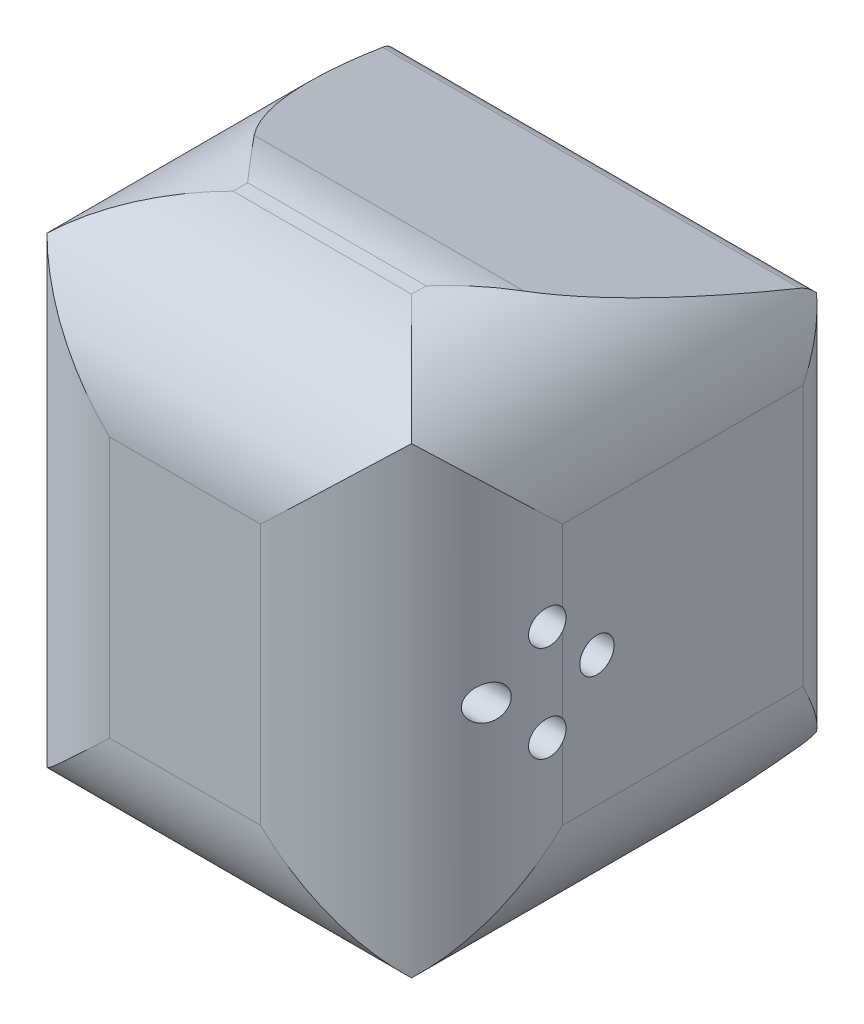
from build123d import *

# Parameters (mm, degrees)
BOSS_1_DEPTH    = 66
CUT_2_DEPTH     = 80
CUT_3_DEPTH     = 80
CUT_4_DEPTH     = 80
CUT_5_DEPTH     = 80
CUT_6_DEPTH     = 62.2
CUT_7_DEPTH     = 62.2
CUT_8_DEPTH     = 62.2
CUT_9_DEPTH     = 62.2
S_CUT10_W       = 52
S_CUT10_H       = 48
POCKET_10_DEPTH = 16.2
S_CUT11_W       = 52
S_CUT11_H       = 60
POCKET_11_DEPTH = 36
S_CUT12_W       = 36
S_CUT12_H       = 48
POCKET_12_DEPTH = 6.1
S_CUT13_W       = 7.2
S_CUT13_H       = 32
POCKET_13_DEPTH = 28
S_HOLE14_R      = 2.5
HOLE_14_DEPTH   = 7.2
S_HOLE15_R      = 2.5
HOLE_15_DEPTH   = 7.2
S_HOLE16_R      = 2.5
HOLE_16_DEPTH   = 7.2
S_HOLE17_R      = 2.5
HOLE_17_DEPTH   = 7.2
S_HOLE18_R      = 1.2
HOLE_18_DEPTH   = 7.2
S_HOLE19_R      = 2.3
HOLE_19_DEPTH   = 2
S_HOLE20_R      = 1.2
HOLE_20_DEPTH   = 7.2
S_HOLE21_R      = 2.3
HOLE_21_DEPTH   = 2


with BuildPart() as part:
    # S_prism1 → Boss_1 (new body)
    with BuildSketch(Plane(origin=(-33, 0, 0), x_dir=(0, 0, -1), z_dir=(1, 0, 0))):
        with BuildLine():
            Line((0, -25.0397), (0, 25.0397))
            ThreePointArc((0, 25.0397), (-0.784802451, 27.419203311), (-2.8311, 28.8651))
            Line((-2.8311, 28.8651), (-32.2859, 37.8651))
            ThreePointArc((-32.2859, 37.8651), (-36.042603994, 38.714700597), (-39.8836, 39))
            Line((-39.8836, 39), (-42, 39))
            ThreePointArc((-42, 39), (-56.1421, 33.1421), (-62, 19))
            Line((-62, 19), (-62, -19))
            ThreePointArc((-62, -19), (-56.1421, -33.1421), (-42, -39))
            Line((-42, -39), (-39.8836, -39))
            ThreePointArc((-39.8836, -39), (-36.042603994, -38.714700597), (-32.2859, -37.8651))
            Line((-32.2859, -37.8651), (-2.8311, -28.8651))
            ThreePointArc((-2.8311, -28.8651), (-0.784802451, -27.419203311), (0, -25.0397))
        make_face()
    extrude(amount=BOSS_1_DEPTH)

    # S_pcut2 → Cut_2 (cut)
    with BuildSketch(Plane(origin=(0, -40, 0), x_dir=(1, 0, 0), z_dir=(0, 1, 0))):
        with BuildLine():
            Line((33.6, -62.6), (11, -62.6))
            Line((11, -62.6), (11, -62))
            ThreePointArc((11, -62), (26.5563, -55.5563), (33, -40))
            Line((33, -40), (33.6, -40))
            Line((33.6, -40), (33.6, -62.6))
        make_face()
    extrude(amount=CUT_2_DEPTH, mode=Mode.SUBTRACT)

    # S_pcut3 → Cut_3 (cut)
    with BuildSketch(Plane(origin=(0, -40, 0), x_dir=(1, 0, 0), z_dir=(0, 1, 0))):
        with BuildLine():
            Line((-33.6, -62.6), (-11, -62.6))
            Line((-11, -62.6), (-11, -62))
            ThreePointArc((-11, -62), (-26.5563, -55.5563), (-33, -40))
            Line((-33, -40), (-33.6, -40))
            Line((-33.6, -40), (-33.6, -62.6))
        make_face()
    extrude(amount=CUT_3_DEPTH, mode=Mode.SUBTRACT)

    # S_pcut4 → Cut_4 (cut)
    with BuildSketch(Plane(origin=(0, -40, 0), x_dir=(1, 0, 0), z_dir=(0, 1, 0))):
        with BuildLine():
            Line((33.6, 0.6), (28, 0.6))
            Line((28, 0.6), (28, 0))
            ThreePointArc((28, 0), (31.5355, -1.4645), (33, -5))
            Line((33, -5), (33.6, -5))
            Line((33.6, -5), (33.6, 0.6))
        make_face()
    extrude(amount=CUT_4_DEPTH, mode=Mode.SUBTRACT)

    # S_pcut5 → Cut_5 (cut)
    with BuildSketch(Plane(origin=(0, -40, 0), x_dir=(1, 0, 0), z_dir=(0, 1, 0))):
        with BuildLine():
            Line((-33.6, 0.6), (-28, 0.6))
            Line((-28, 0.6), (-28, 0))
            ThreePointArc((-28, 0), (-31.5355, -1.4645), (-33, -5))
            Line((-33, -5), (-33.6, -5))
            Line((-33.6, -5), (-33.6, 0.6))
        make_face()
    extrude(amount=CUT_5_DEPTH, mode=Mode.SUBTRACT)

    # S_pcut6 → Cut_6 (cut)
    with BuildSketch(Plane.XY.offset(-0.1)):
        with BuildLine():
            Line((33.6, 39.6), (13, 39.6))
            Line((13, 39.6), (13, 39))
            ThreePointArc((13, 39), (27.1421, 33.1421), (33, 19))
            Line((33, 19), (33.6, 19))
            Line((33.6, 19), (33.6, 39.6))
        make_face()
    extrude(amount=CUT_6_DEPTH, mode=Mode.SUBTRACT)

    # S_pcut7 → Cut_7 (cut)
    with BuildSketch(Plane.XY.offset(-0.1)):
        with BuildLine():
            Line((33.6, -39.6), (13, -39.6))
            Line((13, -39.6), (13, -39))
            ThreePointArc((13, -39), (27.1421, -33.1421), (33, -19))
            Line((33, -19), (33.6, -19))
            Line((33.6, -19), (33.6, -39.6))
        make_face()
    extrude(amount=CUT_7_DEPTH, mode=Mode.SUBTRACT)

    # S_pcut8 → Cut_8 (cut)
    with BuildSketch(Plane.XY.offset(-0.1)):
        with BuildLine():
            Line((-33.6, 39.6), (-13, 39.6))
            Line((-13, 39.6), (-13, 39))
            ThreePointArc((-13, 39), (-27.1421, 33.1421), (-33, 19))
            Line((-33, 19), (-33.6, 19))
            Line((-33.6, 19), (-33.6, 39.6))
        make_face()
    extrude(amount=CUT_8_DEPTH, mode=Mode.SUBTRACT)

    # S_pcut9 → Cut_9 (cut)
    with BuildSketch(Plane.XY.offset(-0.1)):
        with BuildLine():
            Line((-33.6, -39.6), (-13, -39.6))
            Line((-13, -39.6), (-13, -39))
            ThreePointArc((-13, -39), (-27.1421, -33.1421), (-33, -19))
            Line((-33, -19), (-33.6, -19))
            Line((-33.6, -19), (-33.6, -39.6))
        make_face()
    extrude(amount=CUT_9_DEPTH, mode=Mode.SUBTRACT)

    # S_cut10 → Pocket_10 (cut)
    with BuildSketch(Plane.XY.offset(-0.1)):
        Rectangle(S_CUT10_W, S_CUT10_H)
    extrude(amount=POCKET_10_DEPTH, mode=Mode.SUBTRACT)

    # S_cut11 → Pocket_11 (cut)
    with BuildSketch(Plane.XY.offset(16)):
        Rectangle(S_CUT11_W, S_CUT11_H)
    extrude(amount=POCKET_11_DEPTH, mode=Mode.SUBTRACT)

    # S_cut12 → Pocket_12 (cut)
    with BuildSketch(Plane.XY.offset(51.9)):
        Rectangle(S_CUT12_W, S_CUT12_H)
    extrude(amount=POCKET_12_DEPTH, mode=Mode.SUBTRACT)

    # S_cut13 → Pocket_13 (cut)
    with BuildSketch(Plane.XY.offset(16)):
        with Locations((-29.5, 0)):
            Rectangle(S_CUT13_W, S_CUT13_H)
    extrude(amount=POCKET_13_DEPTH, mode=Mode.SUBTRACT)

    # S_hole14 → Hole_14 (cut)
    with BuildSketch(Plane(origin=(25.9, 0, 0), x_dir=(0, 0, -1), z_dir=(1, 0, 0))):
        with Locations(Location((-49, 0, 0), (0, 0, 180))):
            Circle(S_HOLE14_R)
    extrude(amount=HOLE_14_DEPTH, mode=Mode.SUBTRACT)

    # S_hole15 → Hole_15 (cut)
    with BuildSketch(Plane(origin=(25.9, 0, 0), x_dir=(0, 0, -1), z_dir=(1, 0, 0))):
        with Locations(Location((-42, 7, 0), (0, 0, 180))):
            Circle(S_HOLE15_R)
    extrude(amount=HOLE_15_DEPTH, mode=Mode.SUBTRACT)

    # S_hole16 → Hole_16 (cut)
    with BuildSketch(Plane(origin=(25.9, 0, 0), x_dir=(0, 0, -1), z_dir=(1, 0, 0))):
        with Locations(Location((-42, -7, 0), (0, 0, 180))):
            Circle(S_HOLE16_R)
    extrude(amount=HOLE_16_DEPTH, mode=Mode.SUBTRACT)

    # S_hole17 → Hole_17 (cut)
    with BuildSketch(Plane(origin=(25.9, 0, 0), x_dir=(0, 0, -1), z_dir=(1, 0, 0))):
        with Locations(Location((-35, 0, 0), (0, 0, 180))):
            Circle(S_HOLE17_R)
    extrude(amount=HOLE_17_DEPTH, mode=Mode.SUBTRACT)

    # S_hole18 → Hole_18 (cut)
    with BuildSketch(Plane(origin=(-33.1, 0, 0), x_dir=(0, 0, -1), z_dir=(1, 0, 0))):
        with Locations((-8, -10)):
            Circle(S_HOLE18_R)
    extrude(amount=HOLE_18_DEPTH, mode=Mode.SUBTRACT)

    # S_hole19 → Hole_19 (cut)
    with BuildSketch(Plane(origin=(-33.1, 0, 0), x_dir=(0, 0, -1), z_dir=(1, 0, 0))):
        with Locations((-8, -10)):
            Circle(S_HOLE19_R)
    extrude(amount=HOLE_19_DEPTH, mode=Mode.SUBTRACT)

    # S_hole20 → Hole_20 (cut)
    with BuildSketch(Plane(origin=(-33.1, 0, 0), x_dir=(0, 0, -1), z_dir=(1, 0, 0))):
        with Locations((-8, 10)):
            Circle(S_HOLE20_R)
    extrude(amount=HOLE_20_DEPTH, mode=Mode.SUBTRACT)

    # S_hole21 → Hole_21 (cut)
    with BuildSketch(Plane(origin=(-33.1, 0, 0), x_dir=(0, 0, -1), z_dir=(1, 0, 0))):
        with Locations((-8, 10)):
            Circle(S_HOLE21_R)
    extrude(amount=HOLE_21_DEPTH, mode=Mode.SUBTRACT)


solid = part.part
